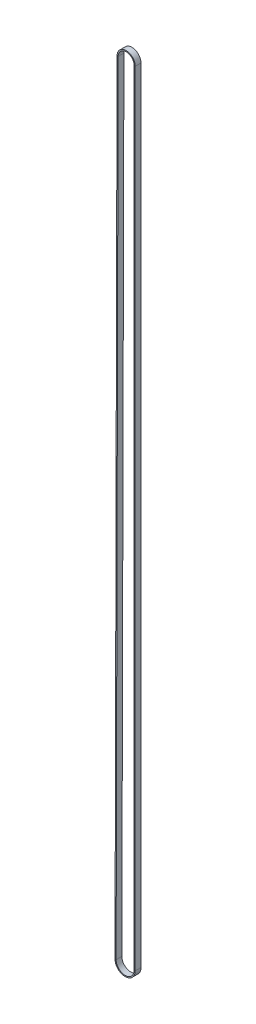
from build123d import *

# Parameters (mm, degrees)
DODANIE_WYCI_GNI_CIE1_DEPTH = 6


with BuildPart() as part:
    # Szkic1 → Dodanie-wyciągnięcie1 (new body)
    with BuildSketch(Plane.XY):
        with BuildLine():
            Line((70.498255823, -96.652679881), (70.498255823, 721.346620302))
            ThreePointArc((70.498255823, 721.346620302), (61.010682473, 730.846612175), (51.498288333, 721.371473582))
            Line((51.498288333, 721.371473582), (49.358291994, -96.625027337))
            ThreePointArc((49.358291994, -96.625027337), (59.914429539, -107.222670838), (70.498255823, -96.652679881))
        make_face()
        with BuildLine():
            Line((69.348255823, -96.652679881), (69.348255823, 721.346620302))
            ThreePointArc((69.348255823, 721.346620302), (61.009178194, 729.696613159), (52.648284397, 721.368465027))
            Line((52.648284397, 721.368465027), (50.508288059, -96.628035892))
            ThreePointArc((50.508288059, -96.628035892), (59.915933818, -106.072671822), (69.348255823, -96.652679881))
        make_face(mode=Mode.SUBTRACT)
    extrude(amount=DODANIE_WYCI_GNI_CIE1_DEPTH)


solid = part.part
